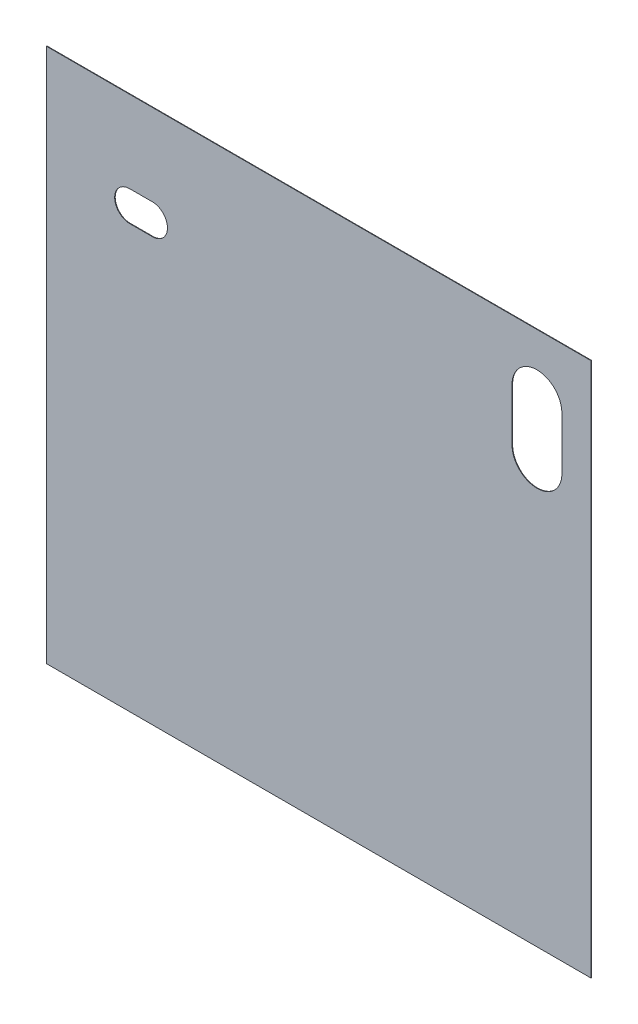
from build123d import *

# Parameters (mm, degrees)
SKETCH1_W           = 509
SKETCH1_H           = 500
BOSS_EXTRUDE1_DEPTH = 0.5
CUT_EXTRUDE4_DEPTH  = 10


with BuildPart() as part:
    # Sketch1 → Boss-Extrude1 (new body)
    with BuildSketch(Plane.XY):
        with Locations((254.5, 250)):
            Rectangle(SKETCH1_W, SKETCH1_H)
        with BuildLine():
            Line((481.865015679, 444.006934605), (481.865015679, 394.675474189))
            ThreePointArc((481.865015679, 394.675474189), (458.585000651, 371.395459161), (435.304985623, 394.675474189))
            Line((435.304985623, 394.675474189), (435.304985623, 444.006934605))
            ThreePointArc((435.304985623, 444.006934605), (458.585000651, 467.286949633), (481.865015679, 444.006934605))
        make_face(mode=Mode.SUBTRACT)
    extrude(amount=BOSS_EXTRUDE1_DEPTH)

    # Sketch8 → Cut-Extrude4 (cut)
    with BuildSketch(Plane.XY.offset(0.5)):
        with BuildLine():
            Line((77.785706476, 423.532533194), (98.958896901, 423.532533194))
            ThreePointArc((98.958896901, 423.532533194), (113.066279785, 409.425150311), (98.958896901, 395.317767427))
            Line((98.958896901, 395.317767427), (77.785706476, 395.317767427))
            ThreePointArc((77.785706476, 395.317767427), (63.678323592, 409.425150311), (77.785706476, 423.532533194))
        make_face()
    extrude(amount=-CUT_EXTRUDE4_DEPTH, mode=Mode.SUBTRACT)


solid = part.part
